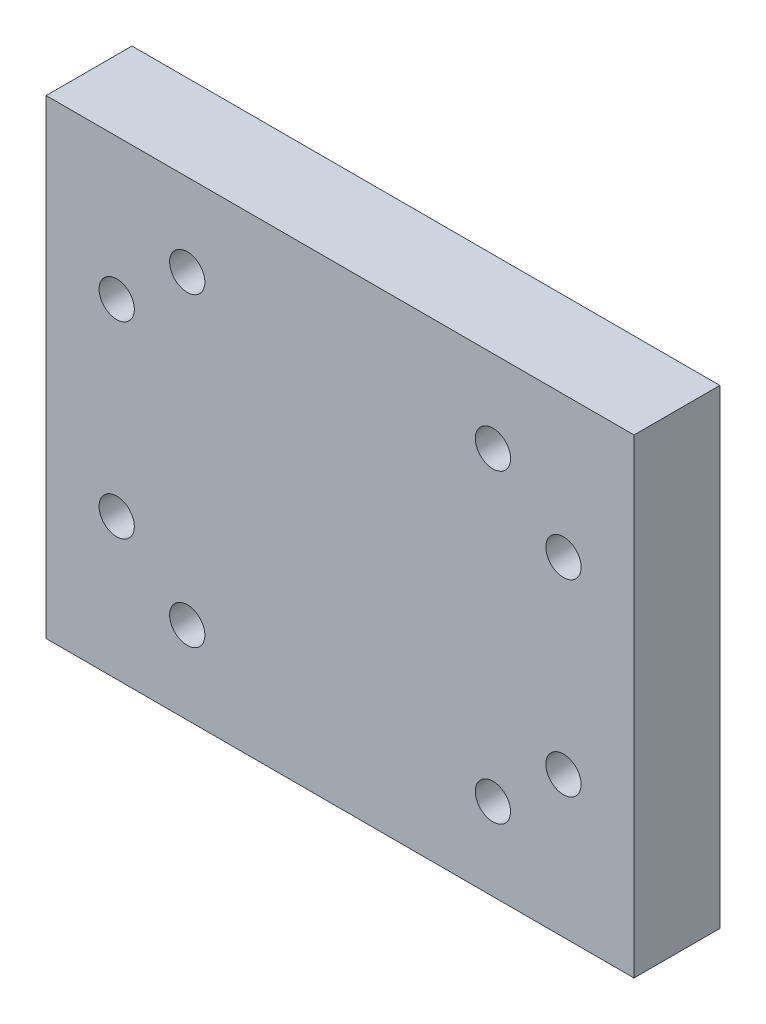
from build123d import *

# Parameters (mm, degrees)
SKETCH1_W               = 50
SKETCH1_H               = 40
SKETCH1_R               = 1.5
BOSS_EXTRUDE1_DEPTH     = 7.3
CUT_EXTRUDE1_DEPTH      = 33.837326322
CUT_EXTRUDE1_DEPTH_BACK = 33.837326322
SKETCH2_R               = 1.5


with BuildPart() as part:
    # Sketch1 → Boss-Extrude1 (new body)
    with BuildSketch(Plane.XY):
        Rectangle(SKETCH1_W, SKETCH1_H)
        with Locations((-13, 13)):
            Circle(SKETCH1_R, mode=Mode.SUBTRACT)
        with Locations(Location((13, 13, 0), (0, 0, 180))):
            Circle(SKETCH1_R, mode=Mode.SUBTRACT)
        with Locations((13, -13)):
            Circle(SKETCH1_R, mode=Mode.SUBTRACT)
        with Locations(Location((-13, -13, 0), (0, 0, 180))):
            Circle(SKETCH1_R, mode=Mode.SUBTRACT)
    extrude(amount=BOSS_EXTRUDE1_DEPTH)

    # Sketch2 → Cut-Extrude1 (cut, two sides: drawn at the far end of the back side and taken through both)
    with BuildSketch(Plane.XY.offset(7.3).offset(-CUT_EXTRUDE1_DEPTH_BACK)):
        with Locations((-19, 8)):
            Circle(SKETCH2_R)
        with Locations((19, 8)):
            Circle(SKETCH2_R)
        with Locations((19, -8)):
            Circle(SKETCH2_R)
        with Locations((-19, -8)):
            Circle(SKETCH2_R)
    extrude(amount=CUT_EXTRUDE1_DEPTH + CUT_EXTRUDE1_DEPTH_BACK, mode=Mode.SUBTRACT)


solid = part.part
